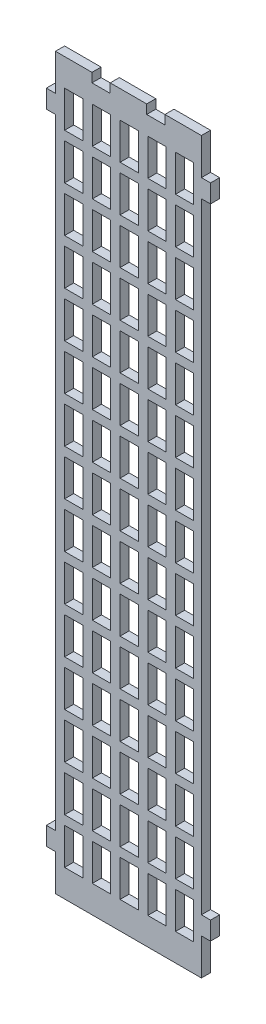
from build123d import *

# Parameters (mm, degrees)
BOSS_EXTRUDE1_DEPTH  = 3.175
SKETCH2_W            = 6.35
SKETCH2_H            = 12.7
CUT_EXTRUDE1_DEPTH   = 260.690934093
LPATTERN1_COUNT      = 5
LPATTERN1_PITCH      = 9.652
LPATTERN1_COUNT_DIR2 = 15
LPATTERN1_PITCH_DIR2 = 15.875


with BuildPart() as part:
    # Sketch1 → Boss-Extrude1 (new body)
    with BuildSketch(Plane.XY):
        Polygon((31.75, 0), (19.05, 0), (19.05, -3.175), (12.7, -3.175), (12.7, 0), (0, 0), (0, -12.7), (-3.175, -12.7), (-3.175, -19.05), (0, -19.05), (0, -234.95), (-3.175, -234.95), (-3.175, -241.3), (0, -241.3), (0, -254), (12.7, -254), (38.1, -254), (50.8, -254), (50.8, -241.3), (53.975, -241.3), (53.975, -234.95), (50.8, -234.95), (50.8, -19.05), (53.975, -19.05), (53.975, -12.7), (50.8, -12.7), (50.8, 0), (38.1, 0), (38.1, -3.175), (31.75, -3.175), align=None)
    extrude(amount=BOSS_EXTRUDE1_DEPTH)

    # Sketch2 → Cut-Extrude1 (cut, through all)
    with BuildSketch(Plane.XY.offset(3.175)):
        with Locations((6.35, -15.875)):
            Rectangle(SKETCH2_W, SKETCH2_H)
    cut_extrude1 = extrude(amount=-CUT_EXTRUDE1_DEPTH, mode=Mode.SUBTRACT)

    # LPattern1: Cut-Extrude1 5 × 15
    with Locations(*[(i * LPATTERN1_PITCH, -j * LPATTERN1_PITCH_DIR2, 0) for i in range(LPATTERN1_COUNT) for j in range(LPATTERN1_COUNT_DIR2) if (i, j) != (0, 0)]):
        add(cut_extrude1, mode=Mode.SUBTRACT)


solid = part.part
